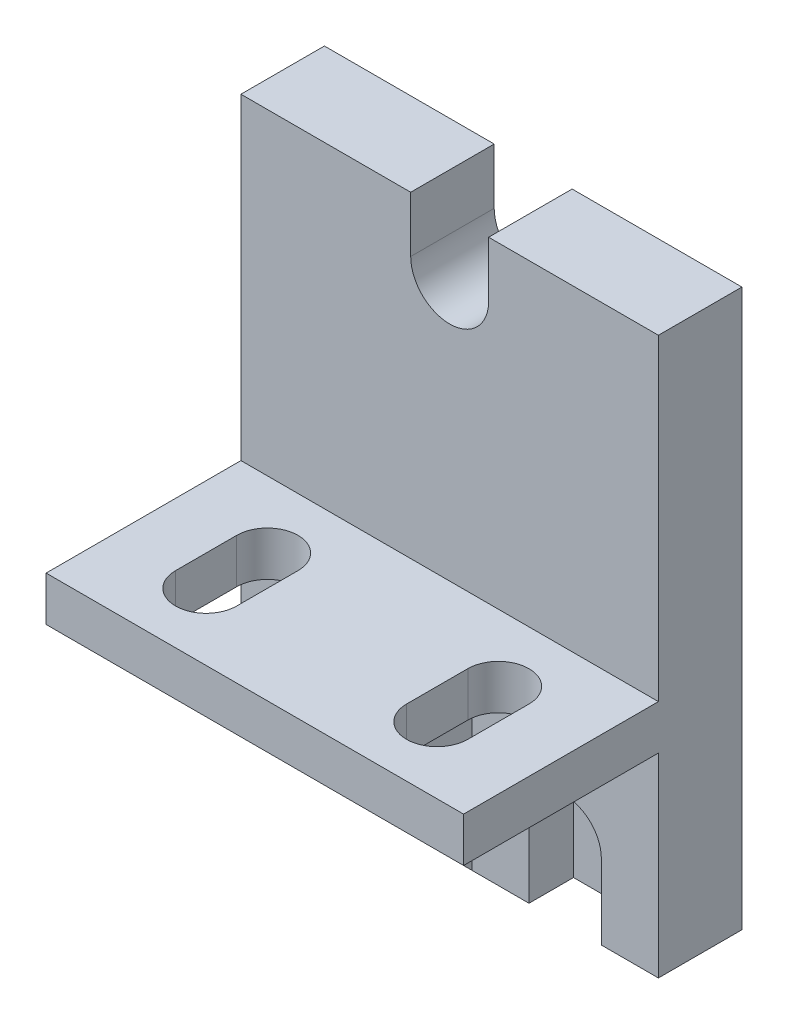
from build123d import *

# Parameters (mm, degrees)
SKETCH_1_W          = 75
SKETCH_1_H          = 100
EXTRUDE_1_DEPTH     = 15
SKETCH_2_W          = 75
SKETCH_2_H          = 8
EXTRUDE_2_DEPTH     = 35
EXTRUDE_3_DEPTH     = 4
CUT_EXTRUDE_1_DEPTH = 91.173443984
CUT_EXTRUDE_2_DEPTH = 8
CUT_EXTRUDE_3_DEPTH = 72.632743909


with BuildPart() as part:
    # Эскиз1 → Бобышка-Вытянуть1 (new body)
    with BuildSketch(Plane.XY):
        Rectangle(SKETCH_1_W, SKETCH_1_H)
    extrude(amount=EXTRUDE_1_DEPTH)

    # Эскиз2 → Бобышка-Вытянуть2 (add)
    with BuildSketch(Plane.XY.offset(15)):
        with Locations((0, -11)):
            Rectangle(SKETCH_2_W, SKETCH_2_H)
    extrude(amount=EXTRUDE_2_DEPTH)

    # Эскиз3 → Бобышка-Вытянуть3 (add, symmetric)
    with BuildSketch(Plane(origin=(0, 0, 0), x_dir=(0, 0, -1), z_dir=(1, 0, 0))):
        Polygon((-50, -15), (-15, -50), (-15, -15), align=None)
    extrude(amount=EXTRUDE_3_DEPTH, both=True)

    # Эскиз4 → Вырез-Вытянуть1 (cut, through all)
    with BuildSketch(Plane.XZ.offset(15)):
        with BuildLine():
            Line((15.25, 27), (15.25, 38))
            ThreePointArc((15.25, 38), (20.75, 43.5), (26.25, 38))
            Line((26.25, 38), (26.25, 27))
            ThreePointArc((26.25, 27), (20.75, 21.5), (15.25, 27))
        make_face()
    cut_extrude_1 = extrude(amount=-CUT_EXTRUDE_1_DEPTH, mode=Mode.SUBTRACT)

    # Эскиз5 → Вырез-Вытянуть2 (cut)
    with BuildSketch(Plane.XY.offset(15)):
        with BuildLine():
            Line((14.25, -63.5), (14.25, -36.5))
            ThreePointArc((14.25, -36.5), (20.75, -30), (27.25, -36.5))
            Line((27.25, -36.5), (27.25, -63.5))
            ThreePointArc((27.25, -63.5), (20.75, -70), (14.25, -63.5))
        make_face()
    cut_extrude_2 = extrude(amount=-CUT_EXTRUDE_2_DEPTH, mode=Mode.SUBTRACT)

    # Эскиз6 → Вырез-Вытянуть3 (cut, through all)
    with BuildSketch(Plane.XY.offset(15)):
        with BuildLine():
            Line((7, 60), (7, 40))
            ThreePointArc((7, 40), (0, 33), (-7, 40))
            Line((-7, 40), (-7, 60))
            ThreePointArc((-7, 60), (0, 67), (7, 60))
        make_face()
    extrude(amount=-CUT_EXTRUDE_3_DEPTH, mode=Mode.SUBTRACT)

    # Зеркальное отражение1: Вырез-Вытянуть1, Вырез-Вытянуть2 across plane
    add(cut_extrude_1.mirror(Plane(origin=(0, 0, 0), x_dir=(0, 0, 1), z_dir=(1, 0, 0))), mode=Mode.SUBTRACT)
    add(cut_extrude_2.mirror(Plane(origin=(0, 0, 0), x_dir=(0, 0, 1), z_dir=(1, 0, 0))), mode=Mode.SUBTRACT)


solid = part.part
